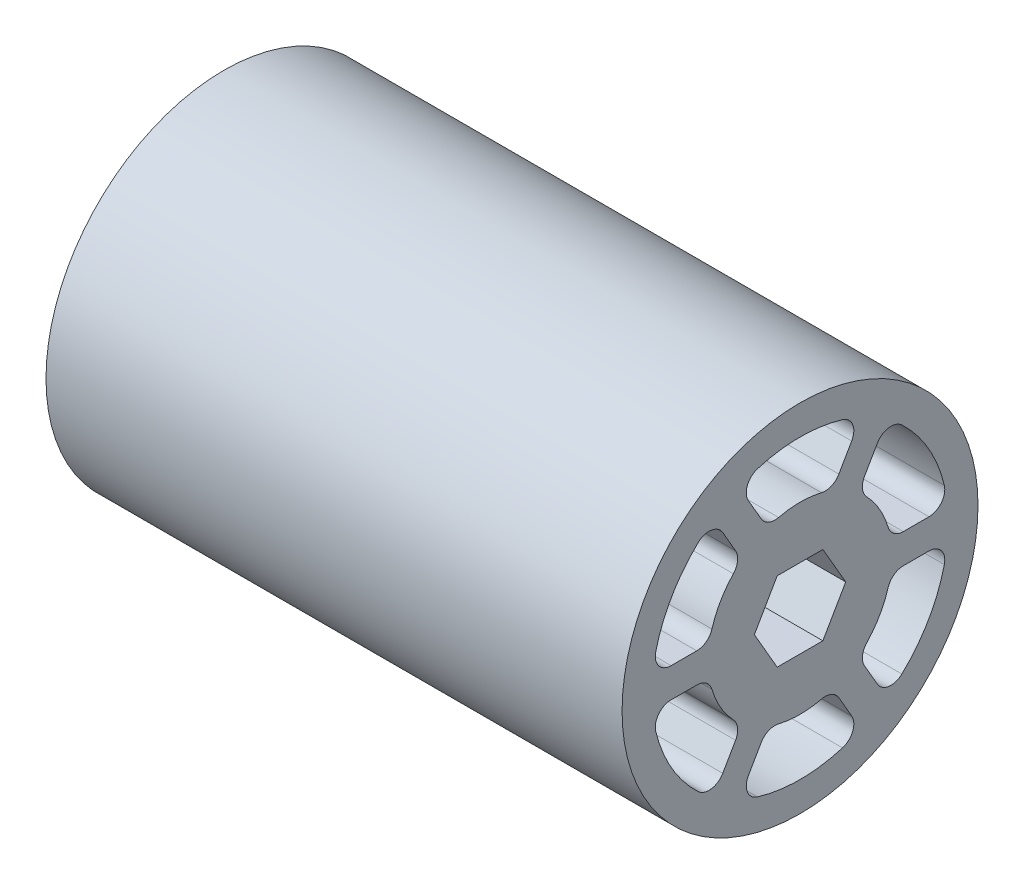
from build123d import *

# Parameters (mm, degrees)
CROQUIS1_R              = 28.575
SALIENTE_EXTRUIR1_DEPTH = 92.5
CORTAR_EXTRUIR1_DEPTH   = 101.942118315


with BuildPart() as part:
    # Croquis1 → Saliente-Extruir1 (new body)
    with BuildSketch(Plane(origin=(0, 0, 0), x_dir=(0, 0, -1), z_dir=(1, 0, 0))):
        Circle(CROQUIS1_R)
        Polygon((7.332348419, 0), (3.666174209, 6.35), (-3.666174209, 6.35), (-7.332348419, 0), (-3.666174209, -6.35), (3.666174209, -6.35), align=None, mode=Mode.SUBTRACT)
    extrude(amount=SALIENTE_EXTRUIR1_DEPTH)

    # Croquis2 → Cortar-Extruir1 (cut, through all)
    with BuildSketch(Plane(origin=(92.5, 0, 0), x_dir=(0, 0, -1), z_dir=(1, 0, 0))):
        with BuildLine():
            Line((-6.233796171, 15.550729765), (-8.292494443, 19.11649977))
            ThreePointArc((-8.292494443, 19.11649977), (-8.452873942, 21.324398032), (-6.820383997, 22.8195612))
            ThreePointArc((-6.820383997, 22.8195612), (0, 23.817682129), (6.820383997, 22.8195612))
            ThreePointArc((6.820383997, 22.8195612), (8.452873942, 21.324398032), (8.292494443, 19.11649977))
            Line((8.292494443, 19.11649977), (6.233796171, 15.550729765))
            ThreePointArc((6.233796171, 15.550729765), (5.037217596, 14.487169273), (3.442097, 14.350965426))
            ThreePointArc((3.442097, 14.350965426), (0, 14.758215751), (-3.442097, 14.350965426))
            ThreePointArc((-3.442097, 14.350965426), (-5.037136467, 14.487358051), (-6.233796171, 15.550729765))
        make_face()
        with BuildLine():
            Line((16.584225127, 2.376739002), (20.701621672, 2.376739002))
            ThreePointArc((20.701621672, 2.376739002), (22.693907405, 3.341795413), (23.172511718, 5.50315476))
            ThreePointArc((23.172511718, 5.50315476), (20.6267178, 11.90884103), (16.352127722, 17.31640637))
            ThreePointArc((16.352127722, 17.31640637), (14.241033463, 17.98260255), (12.409127229, 16.739760699))
            Line((12.409127229, 16.739760699), (10.350428956, 13.173990694))
            ThreePointArc((10.350428956, 13.173990694), (10.02785189, 11.605967133), (10.707252145, 10.156426122))
            ThreePointArc((10.707252145, 10.156426122), (12.780989772, 7.37910784), (14.149349145, 4.194539234))
            ThreePointArc((14.149349145, 4.194539234), (15.064865435, 2.881226199), (16.584225127, 2.376739002))
        make_face()
        with BuildLine():
            Line((10.350428935, -13.173990796), (12.409127207, -16.739760801))
            ThreePointArc((12.409127207, -16.739760801), (14.241033442, -17.982602652), (16.3521277, -17.316406472))
            ThreePointArc((16.3521277, -17.316406472), (20.626717779, -11.908841132), (23.172511697, -5.503154863))
            ThreePointArc((23.172511697, -5.503154863), (22.693907383, -3.341795515), (20.70162165, -2.376739104))
            Line((20.70162165, -2.376739104), (16.584225106, -2.376739104))
            ThreePointArc((16.584225106, -2.376739104), (15.064988336, -2.881390951), (14.149349124, -4.194539336))
            ThreePointArc((14.149349124, -4.194539336), (12.780989751, -7.379107943), (10.707252124, -10.156426225))
            ThreePointArc((10.707252124, -10.156426225), (10.027647818, -11.605943107), (10.350428935, -13.173990796))
        make_face()
        with BuildLine():
            Line((-6.233796214, -15.550729831), (-8.292494486, -19.116499836))
            ThreePointArc((-8.292494486, -19.116499836), (-8.452873985, -21.324398098), (-6.82038404, -22.819561265))
            ThreePointArc((-6.82038404, -22.819561265), (-4.3e-08, -23.817682194), (6.820383954, -22.819561265))
            ThreePointArc((6.820383954, -22.819561265), (8.452873899, -21.324398098), (8.2924944, -19.116499836))
            Line((8.2924944, -19.116499836), (6.233796128, -15.550729831))
            ThreePointArc((6.233796128, -15.550729831), (5.037136424, -14.487358117), (3.442096957, -14.350965491))
            ThreePointArc((3.442096957, -14.350965491), (-4.3e-08, -14.758215816), (-3.442097043, -14.350965491))
            ThreePointArc((-3.442097043, -14.350965491), (-5.037217639, -14.487169339), (-6.233796214, -15.550729831))
        make_face()
        with BuildLine():
            Line((-16.58422517, -2.376739067), (-20.701621714, -2.376739067))
            ThreePointArc((-20.701621714, -2.376739067), (-22.693907448, -3.341795478), (-23.172511761, -5.503154826))
            ThreePointArc((-23.172511761, -5.503154826), (-20.626717843, -11.908841095), (-16.352127764, -17.316406435))
            ThreePointArc((-16.352127764, -17.316406435), (-14.241033506, -17.982602615), (-12.409127271, -16.739760764))
            Line((-12.409127271, -16.739760764), (-10.350428999, -13.173990759))
            ThreePointArc((-10.350428999, -13.173990759), (-10.027851933, -11.605967199), (-10.707252188, -10.156426188))
            ThreePointArc((-10.707252188, -10.156426188), (-12.780989815, -7.379107906), (-14.149349188, -4.194539299))
            ThreePointArc((-14.149349188, -4.194539299), (-15.064865478, -2.881226264), (-16.58422517, -2.376739067))
        make_face()
        with BuildLine():
            Line((-10.350428978, 13.173990731), (-12.40912725, 16.739760736))
            ThreePointArc((-12.40912725, 16.739760736), (-14.241033484, 17.982602587), (-16.352127743, 17.316406407))
            ThreePointArc((-16.352127743, 17.316406407), (-20.626717822, 11.908841067), (-23.17251174, 5.503154797))
            ThreePointArc((-23.17251174, 5.503154797), (-22.693907426, 3.34179545), (-20.701621693, 2.376739039))
            Line((-20.701621693, 2.376739039), (-16.584225148, 2.376739039))
            ThreePointArc((-16.584225148, 2.376739039), (-15.064988378, 2.881390885), (-14.149349166, 4.194539271))
            ThreePointArc((-14.149349166, 4.194539271), (-12.780989794, 7.379107878), (-10.707252167, 10.156426159))
            ThreePointArc((-10.707252167, 10.156426159), (-10.027647861, 11.605943042), (-10.350428978, 13.173990731))
        make_face()
    extrude(amount=-CORTAR_EXTRUIR1_DEPTH, mode=Mode.SUBTRACT)


solid = part.part
